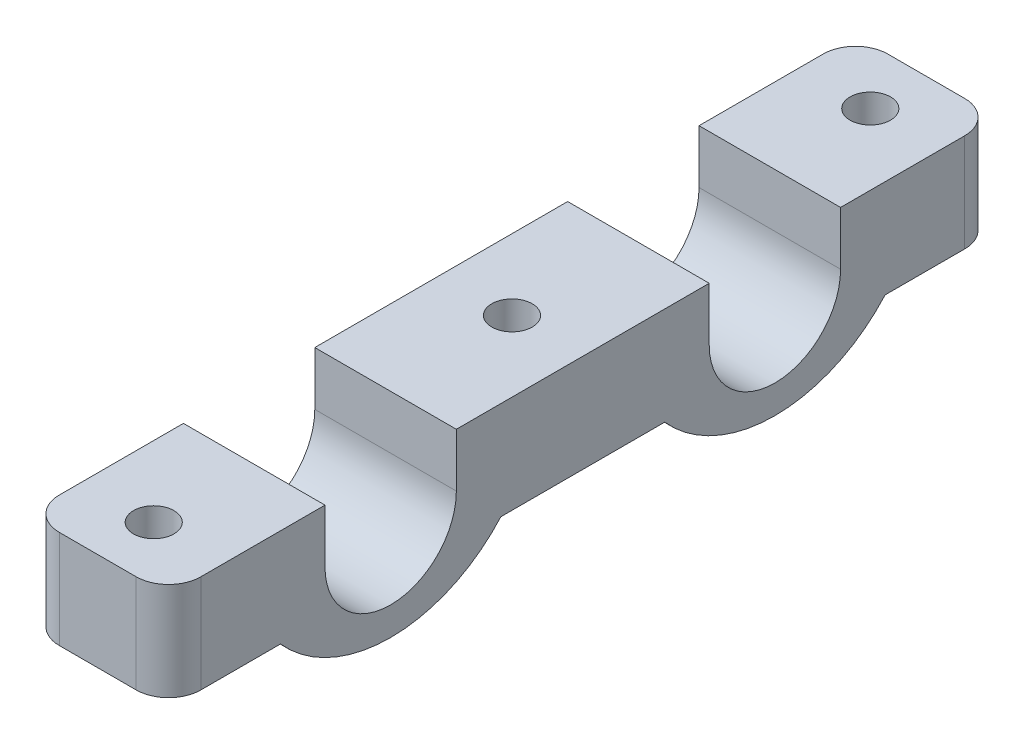
from build123d import *

# Parameters (mm, degrees)
BOSS_EXTRUDE1_DEPTH = 35
CUT_EXTRUDE1_REACH  = 160.215
SKETCH3_R           = 5
SKETCH4_R           = 10.5
CUT_EXTRUDE2_DEPTH  = 10
FILLET1_R           = 8


with BuildPart() as part:
    # Sketch2 → Boss-Extrude1 (new body)
    with BuildSketch(Plane(origin=(0, 0, 0), x_dir=(0, 0, -1), z_dir=(1, 0, 0))):
        with BuildLine():
            Line((-27.24, -11), (-54.920224718, -11))
            Line((-54.920224718, -11), (-54.920224718, 0))
            Line((-54.920224718, 0), (-54.920224718, 13.24))
            Line((-54.920224718, 13.24), (-16.24, 13.24))
            Line((-16.24, 13.24), (-16.24, 0))
            ThreePointArc((-16.24, 0), (0, -16.24), (16.24, 0))
            Line((16.24, 0), (16.24, 13.24))
            Line((16.24, 13.24), (78.76, 13.24))
            Line((78.76, 13.24), (78.76, 0))
            ThreePointArc((78.76, 0), (95, -16.24), (111.24, 0))
            Line((111.24, 0), (111.24, 13.24))
            Line((111.24, 13.24), (149.920224718, 13.24))
            Line((149.920224718, 13.24), (149.920224718, 0))
            Line((149.920224718, 0), (149.920224718, -11))
            Line((149.920224718, -11), (122.24, -11))
            ThreePointArc((122.24, -11), (95, -23.24), (67.76, -11))
            Line((67.76, -11), (27.24, -11))
            ThreePointArc((27.24, -11), (0, -23.24), (-27.24, -11))
        make_face()
    extrude(amount=BOSS_EXTRUDE1_DEPTH)

    # Sketch3 → Cut-Extrude1 (cut, up to next)
    with BuildSketch(Plane(origin=(0, 13.24, 0), x_dir=(1, 0, 0), z_dir=(0, 1, 0)), mode=Mode.PRIVATE) as cut_extrude1_sk1:
        with Locations(Location((17.5, -41.080112359, 0), (0, 0, 270))):
            Circle(SKETCH3_R)
    cut_extrude1_tool1 = extrude(cut_extrude1_sk1.sketch, amount=-CUT_EXTRUDE1_REACH, mode=Mode.PRIVATE) & part.part
    # Sketch3 → Cut-Extrude1 (cut, up to next)
    with BuildSketch(Plane(origin=(0, 13.24, 0), x_dir=(1, 0, 0), z_dir=(0, 1, 0)), mode=Mode.PRIVATE) as cut_extrude1_sk2:
        with Locations(Location((17.5, 136.080112359, 0), (0, 0, 270))):
            Circle(SKETCH3_R)
    cut_extrude1_tool2 = extrude(cut_extrude1_sk2.sketch, amount=-CUT_EXTRUDE1_REACH, mode=Mode.PRIVATE) & part.part
    # Sketch3 → Cut-Extrude1 (cut, up to next)
    with BuildSketch(Plane(origin=(0, 13.24, 0), x_dir=(1, 0, 0), z_dir=(0, 1, 0)), mode=Mode.PRIVATE) as cut_extrude1_sk3:
        with Locations(Location((17.5, 47.5, 0), (0, 0, 270))):
            Circle(SKETCH3_R)
    cut_extrude1_tool3 = extrude(cut_extrude1_sk3.sketch, amount=-CUT_EXTRUDE1_REACH, mode=Mode.PRIVATE) & part.part
    add(cut_extrude1_tool1.solids().sort_by_distance((17.5, 13.24, 41.080112))[0], mode=Mode.SUBTRACT)
    add(cut_extrude1_tool2.solids().sort_by_distance((17.5, 13.24, -136.080112))[0], mode=Mode.SUBTRACT)
    add(cut_extrude1_tool3.solids().sort_by_distance((17.5, 13.24, -47.5))[0], mode=Mode.SUBTRACT)

    # Sketch4 → Cut-Extrude2 (cut)
    with BuildSketch(Plane.XZ.offset(11)):
        with Locations(Location((17.5, -47.5, 0), (0, 0, 270))):
            Circle(SKETCH4_R)
        with Locations(Location((17.5, -136.080112359, 0), (0, 0, 270))):
            Circle(SKETCH4_R)
        with Locations(Location((17.5, 41.080112359, 0), (0, 0, 270))):
            Circle(SKETCH4_R)
    extrude(amount=-CUT_EXTRUDE2_DEPTH, mode=Mode.SUBTRACT)

    # Fillet1
    fillet1_edges = [part.edges().sort_by_distance(p)[0] for p in [
        (35, 1.12, 54.920224718),
        (0, 1.12, -149.920224718),
        (0, 1.12, 54.920224718),
        (35, 1.12, -149.920224718),
    ]]
    fillet(fillet1_edges, radius=FILLET1_R)


solid = part.part
